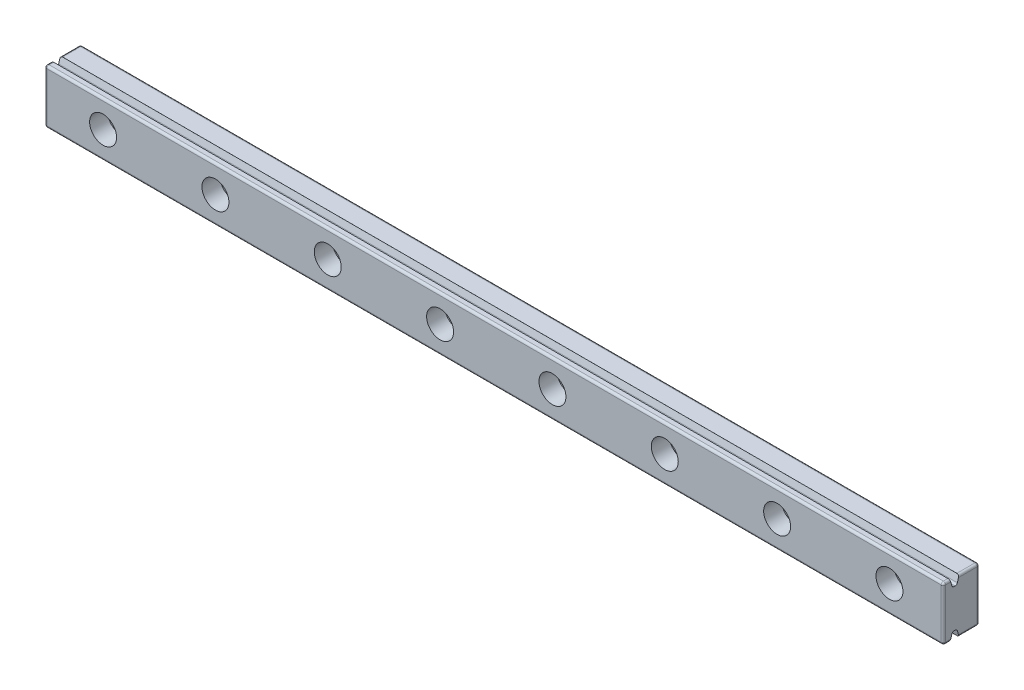
from build123d import *
from OCP.BRepFilletAPI import BRepFilletAPI_MakeChamfer

# Parameters (mm, degrees)
BOSS_EXTRUDE1_DEPTH = 200
SKETCH2_R           = 1.75
CUT_EXTRUDE1_DEPTH  = 10
SKETCH3_R           = 3
CUT_EXTRUDE2_DEPTH  = 4
CHAMFER1_SIZE       = 0.5
CHAMFER1_SIZE2      = 1.743707222
FILLET1_R           = 0.5


with BuildPart() as part:
    # Sketch1 → Boss-Extrude1 (new body)
    with BuildSketch(Plane(origin=(0, 0, 0), x_dir=(0, 0, -1), z_dir=(1, 0, 0))):
        Polygon((-0.5, 6), (4, 6), (4, -6), (-0.5, -6), (-0.5, -4.25), (-2.5, -4.25), (-2.5, -6), (-4, -6), (-4, 6), (-2.5, 6), (-2.5, 4.25), (-0.5, 4.25), align=None)
    extrude(amount=BOSS_EXTRUDE1_DEPTH)

    # Sketch2 → Cut-Extrude1 (cut)
    with BuildSketch(Plane.XY.offset(4)):
        with Locations((13, 0)):
            Circle(SKETCH2_R)
        with Locations((38, 0)):
            Circle(SKETCH2_R)
        with Locations((63, 0)):
            Circle(SKETCH2_R)
        with Locations((88, 0)):
            Circle(SKETCH2_R)
        with Locations((113, 0)):
            Circle(SKETCH2_R)
        with Locations((138, 0)):
            Circle(SKETCH2_R)
        with Locations((163, 0)):
            Circle(SKETCH2_R)
        with Locations((188, 0)):
            Circle(SKETCH2_R)
        with Locations((213, 0)):
            Circle(SKETCH2_R)
        with Locations((238, 0)):
            Circle(SKETCH2_R)
        with Locations((263, 0)):
            Circle(SKETCH2_R)
        with Locations((288, 0)):
            Circle(SKETCH2_R)
        with Locations((313, 0)):
            Circle(SKETCH2_R)
        with Locations((338, 0)):
            Circle(SKETCH2_R)
        with Locations((363, 0)):
            Circle(SKETCH2_R)
        with Locations((388, 0)):
            Circle(SKETCH2_R)
    extrude(amount=-CUT_EXTRUDE1_DEPTH, mode=Mode.SUBTRACT)

    # Sketch3 → Cut-Extrude2 (cut)
    with BuildSketch(Plane.XY.offset(4)):
        with Locations((13, 0)):
            Circle(SKETCH3_R)
        with Locations((38, 0)):
            Circle(SKETCH3_R)
        with Locations((63, 0)):
            Circle(SKETCH3_R)
        with Locations((88, 0)):
            Circle(SKETCH3_R)
        with Locations((113, 0)):
            Circle(SKETCH3_R)
        with Locations((138, 0)):
            Circle(SKETCH3_R)
        with Locations((163, 0)):
            Circle(SKETCH3_R)
        with Locations((188, 0)):
            Circle(SKETCH3_R)
        with Locations((213, 0)):
            Circle(SKETCH3_R)
        with Locations((238, 0)):
            Circle(SKETCH3_R)
        with Locations((263, 0)):
            Circle(SKETCH3_R)
        with Locations((288, 0)):
            Circle(SKETCH3_R)
        with Locations((313, 0)):
            Circle(SKETCH3_R)
        with Locations((338, 0)):
            Circle(SKETCH3_R)
        with Locations((363, 0)):
            Circle(SKETCH3_R)
        with Locations((388, 0)):
            Circle(SKETCH3_R)
    extrude(amount=-CUT_EXTRUDE2_DEPTH, mode=Mode.SUBTRACT)

    # Chamfer1: one chamfer whose edges measure the first distance from different faces: ONE call of the kernel's chamfer builder (chamfer() names one face for all edges)
    chamfer1_edges_1 = [part.edges().sort_by_distance(p)[0] for p in [
        (100, -4.25, 0.5),
        (100, -4.25, 2.5),
    ]]
    chamfer1_side_1 = [part.faces().sort_by_distance(p)[0] for p in [
        (100, -4.25, 1.5),
    ]]
    chamfer1_edges_2 = [part.edges().sort_by_distance(p)[0] for p in [
        (100, 4.25, 2.5),
        (100, 4.25, 0.5),
    ]]
    chamfer1_side_2 = [part.faces().sort_by_distance(p)[0] for p in [
        (100, 4.25, 1.5),
    ]]
    chamfer1 = BRepFilletAPI_MakeChamfer(part.part.solid().wrapped)
    for e in chamfer1_edges_1:
        chamfer1.Add(CHAMFER1_SIZE, CHAMFER1_SIZE2, e.wrapped, chamfer1_side_1[0].wrapped)  # the first distance lies on this face
    for e in chamfer1_edges_2:
        chamfer1.Add(CHAMFER1_SIZE, CHAMFER1_SIZE2, e.wrapped, chamfer1_side_2[0].wrapped)  # the first distance lies on this face
    add(Compound.cast(chamfer1.Shape()), mode=Mode.REPLACE)

    # Fillet1
    fillet1_edges = [part.edges().sort_by_distance(p)[0] for p in [
        (200, -6, -1.75),
        (200, 0, -4),
        (200, 6, -1.75),
        (200, 6, 3.25),
        (200, 0, 4),
        (200, -6, 3.25),
        (0, -6, 3.25),
        (0, -6, -1.75),
        (0, 0, -4),
        (0, 6, -1.75),
        (0, 6, 3.25),
        (0, 0, 4),
        (100, -4.25, 1),
        (100, -4.25, 2),
        (100, 4.25, 2),
        (100, 4.25, 1),
        (100, -6, 4),
        (100, 6, 4),
        (100, -6, -4),
        (100, 6, -4),
    ]]
    fillet(fillet1_edges, radius=FILLET1_R)


solid = part.part
